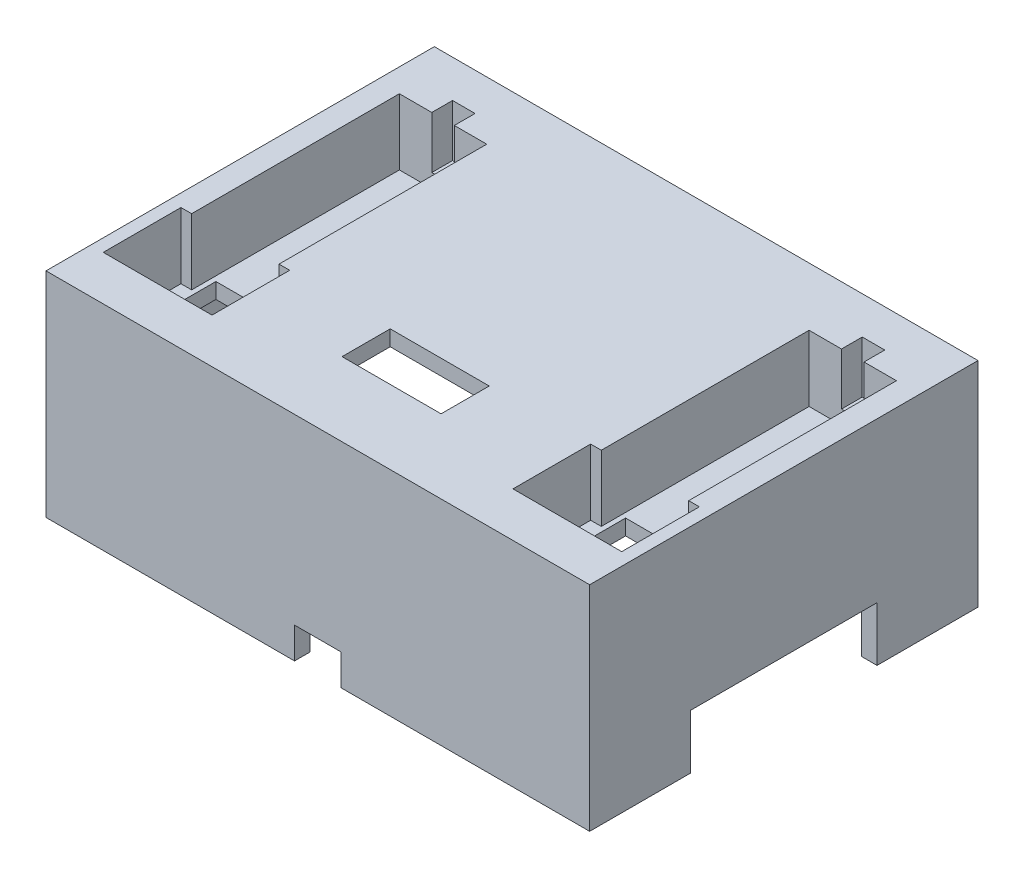
from build123d import *

# Parameters (mm, degrees)
SKETCH1_W           = 140
SKETCH1_H           = 100.00000000000001
BOSS_EXTRUDE1_DEPTH = 55
CUT_EXTRUDE1_DEPTH  = 17
SKETCH3_W           = 5.800000000000001
SKETCH3_H           = 5.340000000000003
SKETCH3_W_2         = 5.799999999999969
CUT_EXTRUDE2_DEPTH  = 13.4
CUT_EXTRUDE3_DEPTH  = 17
SHELL1_T            = -4
CUT_EXTRUDE4_DEPTH  = 177.19307591389622
CUT_EXTRUDE5_DEPTH  = 181.62391868188442
SKETCH9_W           = 48.000000000000014
SKETCH9_H           = 14.000000000000002
CUT_EXTRUDE6_DEPTH  = 181.62391868188442
CUT_EXTRUDE7_DEPTH  = 4


with BuildPart() as part:
    # Sketch1 → Boss-Extrude1 (new body)
    with BuildSketch(Plane(origin=(0, 0, 0), x_dir=(1, 0, 0), z_dir=(0, 1, 0))):
        with Locations((70, 50.00000000000001)):
            Rectangle(SKETCH1_W, SKETCH1_H)
    extrude(amount=BOSS_EXTRUDE1_DEPTH)

    # Sketch2 → Cut-Extrude1 (cut)
    with BuildSketch(Plane(origin=(0, 55, 0), x_dir=(1, 0, 0), z_dir=(0, 1, 0))):
        Polygon((6.000000000000011, 85), (28.50000000000001, 84.99999999999999), (28.50000000000001, 15.000000000000014), (6.000000000000011, 15), align=None)
        Polygon((134.00000000000003, 15.000000000000014), (111.50000000000003, 15.000000000000023), (111.5, 85), (134, 85.00000000000001), align=None)
    extrude(amount=-CUT_EXTRUDE1_DEPTH, mode=Mode.SUBTRACT)

    # Sketch3 → Cut-Extrude2 (cut)
    with BuildSketch(Plane(origin=(0, 55, 0), x_dir=(1, 0, 0), z_dir=(0, 1, 0))):
        with Locations((17.250000000000014, 87.66999999999999)):
            Rectangle(SKETCH3_W, SKETCH3_H)
        with Locations((122.74999999999997, 87.67)):
            Rectangle(SKETCH3_W_2, SKETCH3_H)
    extrude(amount=-CUT_EXTRUDE2_DEPTH, mode=Mode.SUBTRACT)

    # Sketch4 → Cut-Extrude3 (cut)
    with BuildSketch(Plane(origin=(0, 55, 0), x_dir=(1, 0, 0), z_dir=(0, 1, 0))):
        Polygon((3.2500000000000098, 31.5), (31.250000000000014, 31.5), (31.250000000000014, 11.5), (3.2500000000000115, 11.5), align=None)
        Polygon((136.75, 11.500000000000016), (108.75000000000003, 11.500000000000009), (108.75000000000001, 31.500000000000007), (136.75000000000003, 31.500000000000014), align=None)
    extrude(amount=-CUT_EXTRUDE3_DEPTH, mode=Mode.SUBTRACT)

    # Shell1
    shell1_openings = [part.faces().sort_by_distance(p)[0] for p in [
        (70, 0, -50),
    ]]
    offset(amount=SHELL1_T, openings=shell1_openings, kind=Kind.INTERSECTION)

    # Sketch5 → Cut-Extrude4 (cut, through all)
    with BuildSketch(Plane(origin=(0, 38, 0), x_dir=(1, 0, 0), z_dir=(0, 1, 0))):
        Polygon((7.25000000000001, 36.5), (27.250000000000014, 36.5), (27.25000000000001, 18.5), (7.2500000000000115, 18.5), align=None)
        Polygon((132.75000000000003, 18.500000000000014), (112.75000000000001, 18.50000000000001), (112.75000000000001, 36.500000000000014), (132.75000000000003, 36.500000000000014), align=None)
    extrude(amount=-CUT_EXTRUDE4_DEPTH, mode=Mode.SUBTRACT)

    # Sketch6 → Cut-Extrude5 (cut, through all)
    with BuildSketch(Plane(origin=(0, 55, 0), x_dir=(1, 0, 0), z_dir=(0, 1, 0))):
        Polygon((57.24999999999999, 31.38695956479682), (82.75000000000001, 31.38695956479682), (82.75, 18.98695956479682), (57.25000000000001, 18.98695956479682), align=None)
    extrude(amount=-CUT_EXTRUDE5_DEPTH, mode=Mode.SUBTRACT)

    # Sketch9 → Cut-Extrude6 (cut, through all)
    with BuildSketch(Plane(origin=(140, 0, 0), x_dir=(0, 0, -1), z_dir=(1, 0, 0))):
        with Locations((50.00000000000001, 7.000000000000001)):
            Rectangle(SKETCH9_W, SKETCH9_H)
    extrude(amount=-CUT_EXTRUDE6_DEPTH, mode=Mode.SUBTRACT)

    # Sketch8 → Cut-Extrude7 (cut)
    with BuildSketch(Plane.XY):
        Polygon((64, 5.2e-15), (76.00000000000001, 5.2e-15), (76.00000000000001, 8.000000000000004), (64, 8), align=None)
    extrude(amount=-CUT_EXTRUDE7_DEPTH, mode=Mode.SUBTRACT)


solid = part.part
